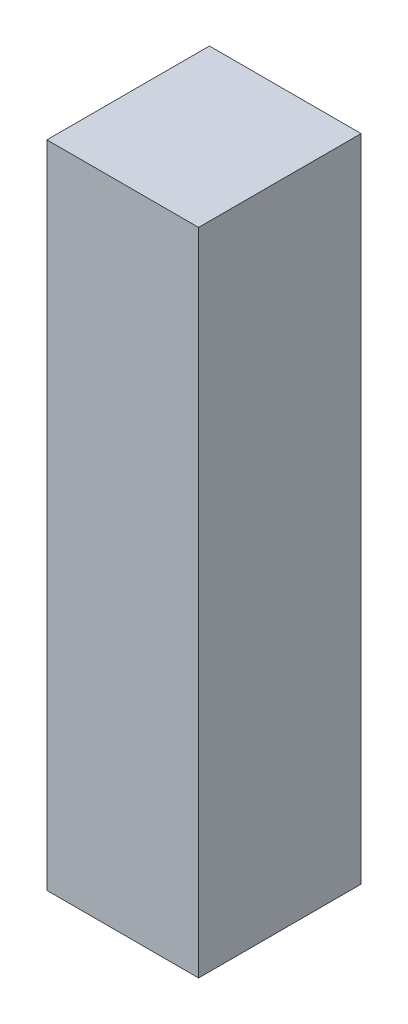
from build123d import *

# Parameters (mm, degrees)
SKETCH_1_W      = 7
SKETCH_1_H      = 7.5
EXTRUDE_1_DEPTH = 30


with BuildPart() as part:
    # Эскиз1 → Вытянуть1 (new body)
    with BuildSketch(Plane(origin=(0, 0, 0), x_dir=(1, 0, 0), z_dir=(0, 1, 0))):
        with Locations((3.5, -3.75)):
            Rectangle(SKETCH_1_W, SKETCH_1_H)
    extrude(amount=EXTRUDE_1_DEPTH)


solid = part.part
